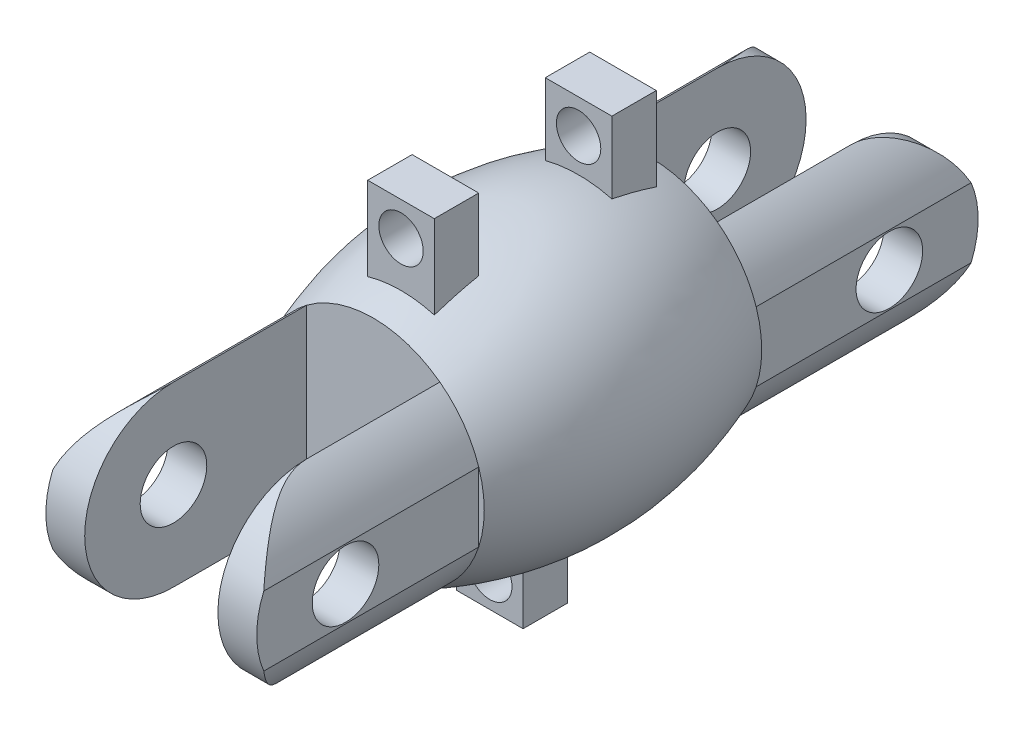
from build123d import *

# Parameters (mm, degrees)
SKETCH3_W                = 19
SKETCH3_H                = 20
BOSS_EXTRUDE2_DEPTH      = 20
SKETCH4_W                = 19
SKETCH4_H                = 20
BOSS_EXTRUDE3_DEPTH      = 20
SKETCH5_R                = 15
SKETCH5_R_2              = 10
CUT_EXTRUDE1_DEPTH       = 49.347699066
SKETCH6_R                = 15
SKETCH6_R_2              = 10
CUT_EXTRUDE2_DEPTH       = 49.347699066
CUT_EXTRUDE3_DEPTH       = 37.996621535
CUT_EXTRUDE3_DEPTH_BACK  = 37.996621535
SKETCH7_W                = 12
SKETCH7_H                = 20
CUT_EXTRUDE4_DEPTH       = 40.430318363
CUT_EXTRUDE4_DEPTH_BACK  = 40.430318363
CUT_EXTRUDE5_DEPTH       = 40.430318445
CUT_EXTRUDE5_DEPTH_BACK  = 40.430318445
CUT_EXTRUDE8_DEPTH       = 42.188590816
CUT_EXTRUDE8_DEPTH_BACK  = 42.188590816
SKETCH10_R               = 3
SKETCH11_W               = 6
SKETCH11_H               = 4
BOSS_EXTRUDE5_DEPTH      = 18
SKETCH12_R               = 2
CUT_EXTRUDE9_DEPTH       = 41.871750794
SKETCH13_W               = 6
SKETCH13_H               = 4
BOSS_EXTRUDE6_DEPTH      = 18
CUT_EXTRUDE10_DEPTH      = 45.300113022
CUT_EXTRUDE10_DEPTH_BACK = 45.300113022
SKETCH14_R               = 2
SCALE1_SCALE             = 0.75


with BuildPart() as part:
    # Sketch2 → Revolve1 (revolve)
    with BuildSketch(Plane(origin=(0, 0, 0), x_dir=(0, 0, -1), z_dir=(1, 0, 0))):
        with BuildLine():
            Line((-12.5, 0), (12.5, 0))
            Line((12.5, 0), (12.5, 10))
            add(Edge.make_bspline(
                [(-12.5, 10), (0, 15), (12.5, 10)],
                knots=[0, 0, 0, 1, 1, 1], degree=2))
            Line((-12.5, 10), (-12.5, 0))
        make_face()
    revolve(axis=Axis((0, 0, 12.5), (0, 0, -1)))

    # Sketch3 → Boss-Extrude2 (add)
    with BuildSketch(Plane.XY.offset(12.5)):
        Rectangle(SKETCH3_W, SKETCH3_H)
    extrude(amount=BOSS_EXTRUDE2_DEPTH)

    # Sketch4 → Boss-Extrude3 (add)
    with BuildSketch(Plane(origin=(0, 0, -12.5), x_dir=(-1, 0, 0), z_dir=(0, 0, -1))):
        Rectangle(SKETCH4_W, SKETCH4_H)
    extrude(amount=BOSS_EXTRUDE3_DEPTH)

    # Sketch5 → Cut-Extrude1 (cut, through all)
    with BuildSketch(Plane(origin=(0, 0, -12.5), x_dir=(-1, 0, 0), z_dir=(0, 0, -1))):
        Circle(SKETCH5_R)
        Circle(SKETCH5_R_2, mode=Mode.SUBTRACT)
    extrude(amount=CUT_EXTRUDE1_DEPTH, mode=Mode.SUBTRACT)

    # Sketch6 → Cut-Extrude2 (cut, through all)
    with BuildSketch(Plane.XY.offset(12.5)):
        Circle(SKETCH6_R)
        Circle(SKETCH6_R_2, mode=Mode.SUBTRACT)
    extrude(amount=CUT_EXTRUDE2_DEPTH, mode=Mode.SUBTRACT)

    # Sketch7 → Cut-Extrude3 (cut, two sides: drawn at the far end of the back side and taken through both)
    with BuildSketch(Plane(origin=(0, 0, 0), x_dir=(1, 0, 0), z_dir=(0, 1, 0)).offset(-CUT_EXTRUDE3_DEPTH_BACK)):
        with Locations((0, 22.5)):
            Rectangle(SKETCH7_W, SKETCH7_H)
        with Locations((0, -22.5)):
            Rectangle(SKETCH7_W, SKETCH7_H)
    extrude(amount=CUT_EXTRUDE3_DEPTH + CUT_EXTRUDE3_DEPTH_BACK, mode=Mode.SUBTRACT)

    # Sketch8 → Cut-Extrude4 (cut, two sides: drawn at the far end of the back side and taken through both)
    with BuildSketch(Plane(origin=(-6, 0, 0), x_dir=(0, 0, -1), z_dir=(1, 0, 0)).offset(-CUT_EXTRUDE4_DEPTH_BACK)):
        with BuildLine():
            Line((-32.5, 8), (-32.5, -5.1e-08))
            ThreePointArc((-32.5, -5.1e-08), (-30.156854267, 5.656854232), (-24.5, 8))
            Line((-24.5, 8), (-32.5, 8))
        make_face()
        with BuildLine():
            Line((-32.5, -8), (-24.5, -8))
            ThreePointArc((-24.5, -8), (-30.156854232, -5.656854267), (-32.5, -5.1e-08))
            Line((-32.5, -5.1e-08), (-32.5, -8))
        make_face()
    extrude(amount=CUT_EXTRUDE4_DEPTH + CUT_EXTRUDE4_DEPTH_BACK, mode=Mode.SUBTRACT)

    # Sketch9 → Cut-Extrude5 (cut, two sides: drawn at the far end of the back side and taken through both)
    with BuildSketch(Plane(origin=(-6, 0, 0), x_dir=(0, 0, -1), z_dir=(1, 0, 0)).offset(-CUT_EXTRUDE5_DEPTH_BACK)):
        with BuildLine():
            ThreePointArc((24.5, 8), (30.156854249, 5.656854249), (32.5, 0))
            Line((32.5, 0), (32.5, 8))
            Line((32.5, 8), (24.5, 8))
        make_face()
        with BuildLine():
            ThreePointArc((32.5, 0), (30.156854249, -5.656854249), (24.5, -8))
            Line((24.5, -8), (32.5, -8))
            Line((32.5, -8), (32.5, 0))
        make_face()
    extrude(amount=CUT_EXTRUDE5_DEPTH + CUT_EXTRUDE5_DEPTH_BACK, mode=Mode.SUBTRACT)

    # Sketch10 → Cut-Extrude8 (cut, two sides: drawn at the far end of the back side and taken through both)
    with BuildSketch(Plane(origin=(9.5, 0, 0), x_dir=(0, 0, -1), z_dir=(1, 0, 0)).offset(-CUT_EXTRUDE8_DEPTH_BACK)):
        with Locations((24.5, 0)):
            Circle(SKETCH10_R)
        with Locations((-24.5, 0)):
            Circle(SKETCH10_R)
    extrude(amount=CUT_EXTRUDE8_DEPTH + CUT_EXTRUDE8_DEPTH_BACK, mode=Mode.SUBTRACT)

    # Sketch11 → Boss-Extrude5 (add)
    with BuildSketch(Plane(origin=(0, 0, 0), x_dir=(1, 0, 0), z_dir=(0, 1, 0))):
        Rectangle(SKETCH11_W, SKETCH11_H)
    extrude(amount=-BOSS_EXTRUDE5_DEPTH)

    # Sketch12 → Cut-Extrude9 (cut, through all)
    with BuildSketch(Plane(origin=(0, 0, -2), x_dir=(-1, 0, 0), z_dir=(0, 0, -1))):
        with Locations((0, -15.218)):
            Circle(SKETCH12_R)
    extrude(amount=-CUT_EXTRUDE9_DEPTH, mode=Mode.SUBTRACT)

    # Sketch13 → Boss-Extrude6 (add)
    with BuildSketch(Plane(origin=(0, 0, 0), x_dir=(1, 0, 0), z_dir=(0, 1, 0))):
        with Locations((0, 8)):
            Rectangle(SKETCH13_W, SKETCH13_H)
        with Locations((0, -8)):
            Rectangle(SKETCH13_W, SKETCH13_H)
    extrude(amount=BOSS_EXTRUDE6_DEPTH)

    # Sketch14 → Cut-Extrude10 (cut, two sides: drawn at the far end of the back side and taken through both)
    with BuildSketch(Plane.XY.offset(-6).offset(-CUT_EXTRUDE10_DEPTH_BACK)):
        with Locations((0, 14.962)):
            Circle(SKETCH14_R)
    extrude(amount=CUT_EXTRUDE10_DEPTH + CUT_EXTRUDE10_DEPTH_BACK, mode=Mode.SUBTRACT)


with BuildPart() as part_1:
    # Scale1: scaled about (2.6e-08, 0.137076755, -6.1e-08)
    add(part.part.scale(SCALE1_SCALE).moved(Location((7e-09, 0.034269189, -1.5e-08))))


solid = part_1.part
